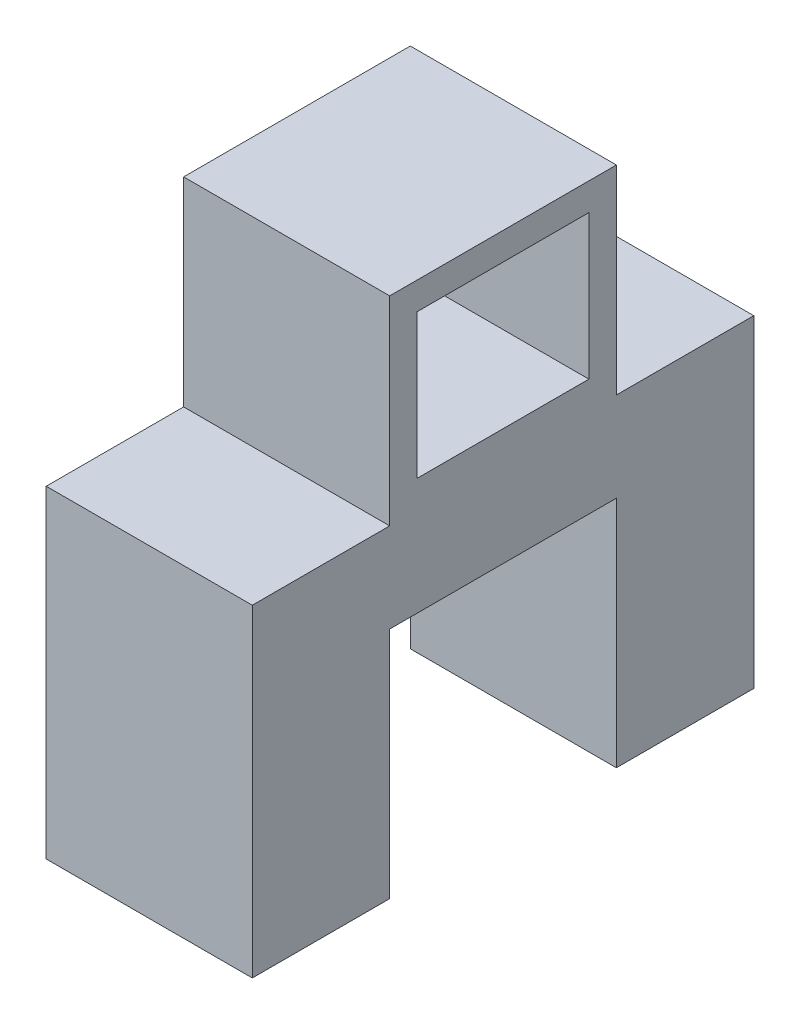
from build123d import *

# Parameters (mm, degrees)
SKETCH1_W           = 12.5
SKETCH1_H           = 10.5
BOSS_EXTRUDE1_DEPTH = 15


with BuildPart() as part:
    # Sketch1 → Boss-Extrude1 (new body)
    with BuildSketch(Plane(origin=(0, 0, 0), x_dir=(0, 0, -1), z_dir=(1, 0, 0))):
        Polygon((-2, 2), (-2, -12.5), (-12, -12.5), (-12, -36), (-2, -36), (-2, -19.003381794), (14.5, -19.003381794), (14.5, -36), (24.5, -36), (24.5, -12.5), (14.5, -12.5), (14.5, 2), align=None)
        with Locations((6.25, -5.25)):
            Rectangle(SKETCH1_W, SKETCH1_H, mode=Mode.SUBTRACT)
    extrude(amount=BOSS_EXTRUDE1_DEPTH)


solid = part.part
